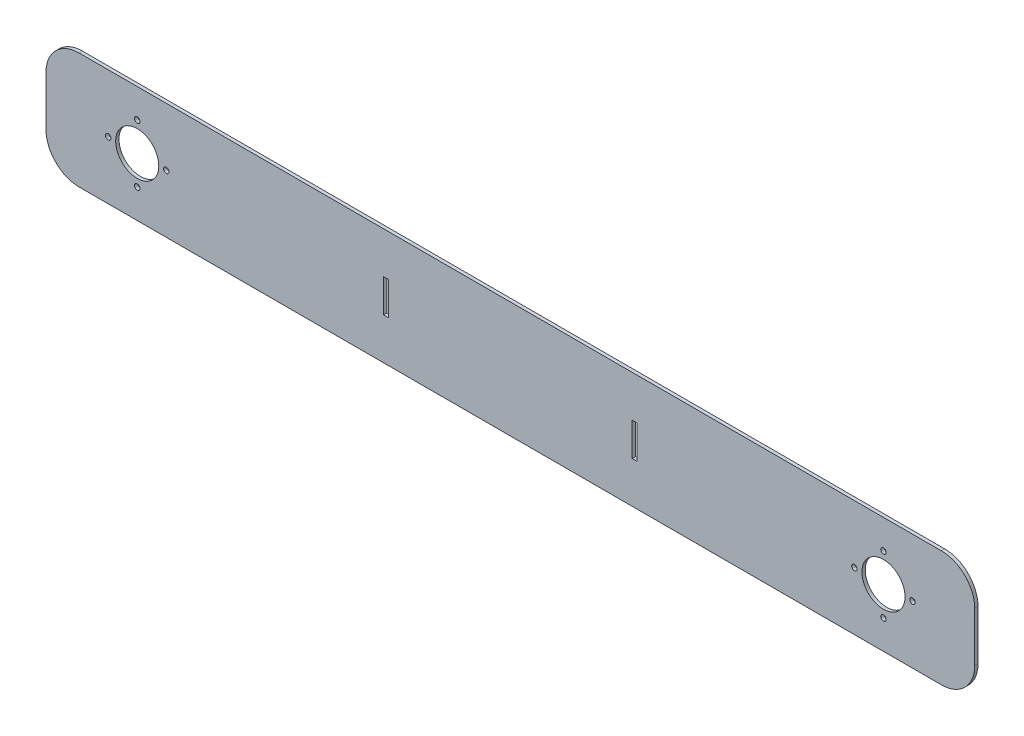
from build123d import *

# Parameters (mm, degrees)
EXTRUDE_1_DEPTH      = 2
CUT_EXTRUDE_1_REACH  = 306.145
SKETCH_3_R           = 13
SKETCH_3_R_2         = 1.65
SKETCH_6_OUTSIDE_W   = 723.656
SKETCH_6_OUTSIDE_H   = 223.656
SKETCH_6_OUTSIDE_W_2 = 773.893791272
SKETCH_6_OUTSIDE_H_2 = 70
CUT_EXTRUDE_4_DEPTH  = 10
SKETCH_7_W           = 40
SKETCH_7_H           = 125.252157634
SKETCH_7_H_2         = 116.31531122
CUT_EXTRUDE_5_DEPTH  = 10
FILLET_1_R           = 20
SKETCH_10_W          = 3
SKETCH_10_H          = 20
CUT_EXTRUDE_6_DEPTH  = 10


with BuildPart() as part:
    # 草图2 → 凸台-拉伸1 (new body)
    with BuildSketch(Plane.XY):
        with BuildLine():
            Line((-280, 50), (280, 50))
            ThreePointArc((280, 50), (294.142135624, 44.142135624), (300, 30))
            Line((300, 30), (300, -30))
            ThreePointArc((300, -30), (294.142135624, -44.142135624), (280, -50))
            Line((280, -50), (-280, -50))
            ThreePointArc((-280, -50), (-294.142135624, -44.142135624), (-300, -30))
            Line((-300, -30), (-300, 30))
            ThreePointArc((-300, 30), (-294.142135624, 44.142135624), (-280, 50))
        make_face()
    extrude(amount=EXTRUDE_1_DEPTH)

    # 草图3 → 切除-拉伸1 (cut, up to next)
    with BuildSketch(Plane.XY.offset(2), mode=Mode.PRIVATE) as cut_extrude_1_sk1:
        with Locations((-225, 0)):
            Circle(SKETCH_3_R)
    cut_extrude_1_tool1 = extrude(cut_extrude_1_sk1.sketch, amount=-CUT_EXTRUDE_1_REACH, mode=Mode.PRIVATE) & part.part
    # 草图3 → 切除-拉伸1 (cut, up to next)
    with BuildSketch(Plane.XY.offset(2), mode=Mode.PRIVATE) as cut_extrude_1_sk2:
        with Locations((225, 0)):
            Circle(SKETCH_3_R)
    cut_extrude_1_tool2 = extrude(cut_extrude_1_sk2.sketch, amount=-CUT_EXTRUDE_1_REACH, mode=Mode.PRIVATE) & part.part
    # 草图3 → 切除-拉伸1 (cut, up to next)
    with BuildSketch(Plane.XY.offset(2), mode=Mode.PRIVATE) as cut_extrude_1_sk3:
        with Locations((-242.5, 0)):
            Circle(SKETCH_3_R_2)
    cut_extrude_1_tool3 = extrude(cut_extrude_1_sk3.sketch, amount=-CUT_EXTRUDE_1_REACH, mode=Mode.PRIVATE) & part.part
    # 草图3 → 切除-拉伸1 (cut, up to next)
    with BuildSketch(Plane.XY.offset(2), mode=Mode.PRIVATE) as cut_extrude_1_sk4:
        with Locations((-207.5, 0)):
            Circle(SKETCH_3_R_2)
    cut_extrude_1_tool4 = extrude(cut_extrude_1_sk4.sketch, amount=-CUT_EXTRUDE_1_REACH, mode=Mode.PRIVATE) & part.part
    # 草图3 → 切除-拉伸1 (cut, up to next)
    with BuildSketch(Plane.XY.offset(2), mode=Mode.PRIVATE) as cut_extrude_1_sk5:
        with Locations((-225, 17.5)):
            Circle(SKETCH_3_R_2)
    cut_extrude_1_tool5 = extrude(cut_extrude_1_sk5.sketch, amount=-CUT_EXTRUDE_1_REACH, mode=Mode.PRIVATE) & part.part
    # 草图3 → 切除-拉伸1 (cut, up to next)
    with BuildSketch(Plane.XY.offset(2), mode=Mode.PRIVATE) as cut_extrude_1_sk6:
        with Locations((-225, -17.5)):
            Circle(SKETCH_3_R_2)
    cut_extrude_1_tool6 = extrude(cut_extrude_1_sk6.sketch, amount=-CUT_EXTRUDE_1_REACH, mode=Mode.PRIVATE) & part.part
    # 草图3 → 切除-拉伸1 (cut, up to next)
    with BuildSketch(Plane.XY.offset(2), mode=Mode.PRIVATE) as cut_extrude_1_sk7:
        with Locations((242.5, 0)):
            Circle(SKETCH_3_R_2)
    cut_extrude_1_tool7 = extrude(cut_extrude_1_sk7.sketch, amount=-CUT_EXTRUDE_1_REACH, mode=Mode.PRIVATE) & part.part
    # 草图3 → 切除-拉伸1 (cut, up to next)
    with BuildSketch(Plane.XY.offset(2), mode=Mode.PRIVATE) as cut_extrude_1_sk8:
        with Locations((225, 17.5)):
            Circle(SKETCH_3_R_2)
    cut_extrude_1_tool8 = extrude(cut_extrude_1_sk8.sketch, amount=-CUT_EXTRUDE_1_REACH, mode=Mode.PRIVATE) & part.part
    # 草图3 → 切除-拉伸1 (cut, up to next)
    with BuildSketch(Plane.XY.offset(2), mode=Mode.PRIVATE) as cut_extrude_1_sk9:
        with Locations((207.5, 0)):
            Circle(SKETCH_3_R_2)
    cut_extrude_1_tool9 = extrude(cut_extrude_1_sk9.sketch, amount=-CUT_EXTRUDE_1_REACH, mode=Mode.PRIVATE) & part.part
    # 草图3 → 切除-拉伸1 (cut, up to next)
    with BuildSketch(Plane.XY.offset(2), mode=Mode.PRIVATE) as cut_extrude_1_sk10:
        with Locations((225, -17.5)):
            Circle(SKETCH_3_R_2)
    cut_extrude_1_tool10 = extrude(cut_extrude_1_sk10.sketch, amount=-CUT_EXTRUDE_1_REACH, mode=Mode.PRIVATE) & part.part
    add(cut_extrude_1_tool1.solids().sort_by_distance((-225, 0, 2))[0], mode=Mode.SUBTRACT)
    add(cut_extrude_1_tool2.solids().sort_by_distance((225, 0, 2))[0], mode=Mode.SUBTRACT)
    add(cut_extrude_1_tool3.solids().sort_by_distance((-242.5, 0, 2))[0], mode=Mode.SUBTRACT)
    add(cut_extrude_1_tool4.solids().sort_by_distance((-207.5, 0, 2))[0], mode=Mode.SUBTRACT)
    add(cut_extrude_1_tool5.solids().sort_by_distance((-225, 17.5, 2))[0], mode=Mode.SUBTRACT)
    add(cut_extrude_1_tool6.solids().sort_by_distance((-225, -17.5, 2))[0], mode=Mode.SUBTRACT)
    add(cut_extrude_1_tool7.solids().sort_by_distance((242.5, 0, 2))[0], mode=Mode.SUBTRACT)
    add(cut_extrude_1_tool8.solids().sort_by_distance((225, 17.5, 2))[0], mode=Mode.SUBTRACT)
    add(cut_extrude_1_tool9.solids().sort_by_distance((207.5, 0, 2))[0], mode=Mode.SUBTRACT)
    add(cut_extrude_1_tool10.solids().sort_by_distance((225, -17.5, 2))[0], mode=Mode.SUBTRACT)

    # 草图6 outside → 切除-拉伸4 (cut)
    with BuildSketch(Plane.XY.offset(2)):
        Rectangle(SKETCH_6_OUTSIDE_W, SKETCH_6_OUTSIDE_H)
        Rectangle(SKETCH_6_OUTSIDE_W_2, SKETCH_6_OUTSIDE_H_2, mode=Mode.SUBTRACT)
    extrude(amount=-CUT_EXTRUDE_4_DEPTH, mode=Mode.SUBTRACT)

    # 草图7 → 切除-拉伸5 (cut)
    with BuildSketch(Plane.XY.offset(2)):
        with Locations((-300, 0)):
            Rectangle(SKETCH_7_W, SKETCH_7_H)
        with Locations((300, 0)):
            Rectangle(SKETCH_7_W, SKETCH_7_H_2)
    extrude(amount=-CUT_EXTRUDE_5_DEPTH, mode=Mode.SUBTRACT)

    # 圆角1
    fillet_1_edges = [part.edges().sort_by_distance(p)[0] for p in [
        (-280, 35, 1),
        (-280, -35, 1),
        (280, 35, 1),
        (280, -35, 1),
    ]]
    fillet(fillet_1_edges, radius=FILLET_1_R)

    # 草图10 → 切除-拉伸6 (cut)
    with BuildSketch(Plane.XY.offset(2)):
        with Locations((-75, 0)):
            Rectangle(SKETCH_10_W, SKETCH_10_H)
        with Locations((75, 0)):
            Rectangle(SKETCH_10_W, SKETCH_10_H)
    extrude(amount=-CUT_EXTRUDE_6_DEPTH, mode=Mode.SUBTRACT)


solid = part.part
